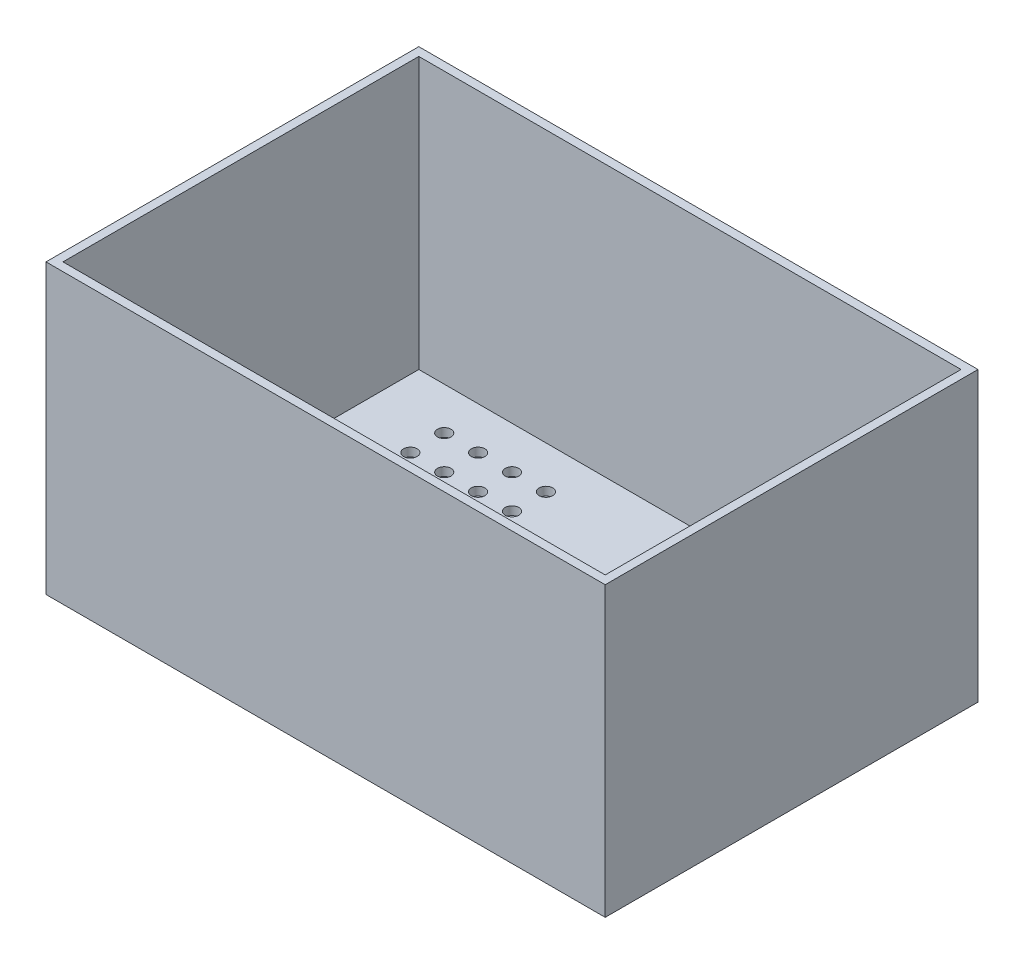
from build123d import *

# Parameters (mm, degrees)
SKETCH1_W           = 209.55
SKETCH1_H           = 139.7
SKETCH1_W_2         = 203.2
SKETCH1_H_2         = 133.35
BOSS_EXTRUDE1_DEPTH = 101.6
SKETCH2_W           = 209.55
SKETCH2_H           = 139.7
BOSS_EXTRUDE2_DEPTH = 3.175
SKETCH3_R           = 2.54
CUT_EXTRUDE1_DEPTH  = 162.800442289
SKETCH4_W           = 209.55
SKETCH4_H           = 139.7
BOSS_EXTRUDE3_DEPTH = 3.175


with BuildPart() as part:
    # Sketch1 → Boss-Extrude1 (new body)
    with BuildSketch(Plane(origin=(0, 0, 0), x_dir=(1, 0, 0), z_dir=(0, 1, 0))):
        Rectangle(SKETCH1_W, SKETCH1_H)
        Rectangle(SKETCH1_W_2, SKETCH1_H_2, mode=Mode.SUBTRACT)
    extrude(amount=BOSS_EXTRUDE1_DEPTH)

    # Sketch2 → Boss-Extrude2 (add)
    with BuildSketch(Plane(origin=(0, 0, 0), x_dir=(1, 0, 0), z_dir=(0, 1, 0))):
        Rectangle(SKETCH2_W, SKETCH2_H)
    extrude(amount=-BOSS_EXTRUDE2_DEPTH)

    # Sketch3 → Cut-Extrude1 (cut, through all)
    with BuildSketch(Plane(origin=(0, 0, 0), x_dir=(1, 0, 0), z_dir=(0, 1, 0))):
        with Locations(Location((-76.2, 50.8, 0), (0, 0, 270))):
            Circle(SKETCH3_R)
        with Locations(Location((-63.5, 50.8, 0), (0, 0, 270))):
            Circle(SKETCH3_R)
        with Locations(Location((-50.8, 50.8, 0), (0, 0, 270))):
            Circle(SKETCH3_R)
        with Locations(Location((-38.1, 50.8, 0), (0, 0, 270))):
            Circle(SKETCH3_R)
        with Locations(Location((-63.5, 38.1, 0), (0, 0, 270))):
            Circle(SKETCH3_R)
        with Locations(Location((-50.8, 38.1, 0), (0, 0, 270))):
            Circle(SKETCH3_R)
        with Locations(Location((-38.1, 38.1, 0), (0, 0, 270))):
            Circle(SKETCH3_R)
        with Locations(Location((-63.5, 25.4, 0), (0, 0, 270))):
            Circle(SKETCH3_R)
        with Locations(Location((-50.8, 25.4, 0), (0, 0, 270))):
            Circle(SKETCH3_R)
        with Locations(Location((-38.1, 25.4, 0), (0, 0, 270))):
            Circle(SKETCH3_R)
        with Locations(Location((-63.5, 12.7, 0), (0, 0, 270))):
            Circle(SKETCH3_R)
        with Locations(Location((-50.8, 12.7, 0), (0, 0, 270))):
            Circle(SKETCH3_R)
        with Locations(Location((-38.1, 12.7, 0), (0, 0, 270))):
            Circle(SKETCH3_R)
        with Locations(Location((-63.5, 0, 0), (0, 0, 270))):
            Circle(SKETCH3_R)
        with Locations(Location((-50.8, 0, 0), (0, 0, 270))):
            Circle(SKETCH3_R)
        with Locations(Location((-38.1, 0, 0), (0, 0, 270))):
            Circle(SKETCH3_R)
        with Locations(Location((-63.5, -12.7, 0), (0, 0, 270))):
            Circle(SKETCH3_R)
        with Locations(Location((-50.8, -12.7, 0), (0, 0, 270))):
            Circle(SKETCH3_R)
        with Locations(Location((-38.1, -12.7, 0), (0, 0, 270))):
            Circle(SKETCH3_R)
        with Locations(Location((-63.5, -25.4, 0), (0, 0, 270))):
            Circle(SKETCH3_R)
        with Locations(Location((-50.8, -25.4, 0), (0, 0, 270))):
            Circle(SKETCH3_R)
        with Locations(Location((-38.1, -25.4, 0), (0, 0, 270))):
            Circle(SKETCH3_R)
        with Locations(Location((-63.5, -38.1, 0), (0, 0, 270))):
            Circle(SKETCH3_R)
        with Locations(Location((-50.8, -38.1, 0), (0, 0, 270))):
            Circle(SKETCH3_R)
        with Locations(Location((-38.1, -38.1, 0), (0, 0, 270))):
            Circle(SKETCH3_R)
        with Locations(Location((-63.5, -50.8, 0), (0, 0, 270))):
            Circle(SKETCH3_R)
        with Locations(Location((-50.8, -50.8, 0), (0, 0, 270))):
            Circle(SKETCH3_R)
        with Locations(Location((-38.1, -50.8, 0), (0, 0, 270))):
            Circle(SKETCH3_R)
        with Locations(Location((-76.2, 38.1, 0), (0, 0, 270))):
            Circle(SKETCH3_R)
        with Locations(Location((-76.2, 25.4, 0), (0, 0, 270))):
            Circle(SKETCH3_R)
        with Locations(Location((-76.2, 12.7, 0), (0, 0, 270))):
            Circle(SKETCH3_R)
        with Locations(Location((-76.2, 0, 0), (0, 0, 270))):
            Circle(SKETCH3_R)
        with Locations(Location((-76.2, -12.7, 0), (0, 0, 270))):
            Circle(SKETCH3_R)
        with Locations(Location((-76.2, -25.4, 0), (0, 0, 270))):
            Circle(SKETCH3_R)
        with Locations(Location((-76.2, -38.1, 0), (0, 0, 270))):
            Circle(SKETCH3_R)
        with Locations(Location((-76.2, -50.8, 0), (0, 0, 270))):
            Circle(SKETCH3_R)
    extrude(amount=-CUT_EXTRUDE1_DEPTH, mode=Mode.SUBTRACT)

    # Sketch4 → Boss-Extrude3 (add)
    with BuildSketch(Plane.XZ.offset(3.175)):
        Rectangle(SKETCH4_W, SKETCH4_H)
    extrude(amount=BOSS_EXTRUDE3_DEPTH)


solid = part.part
